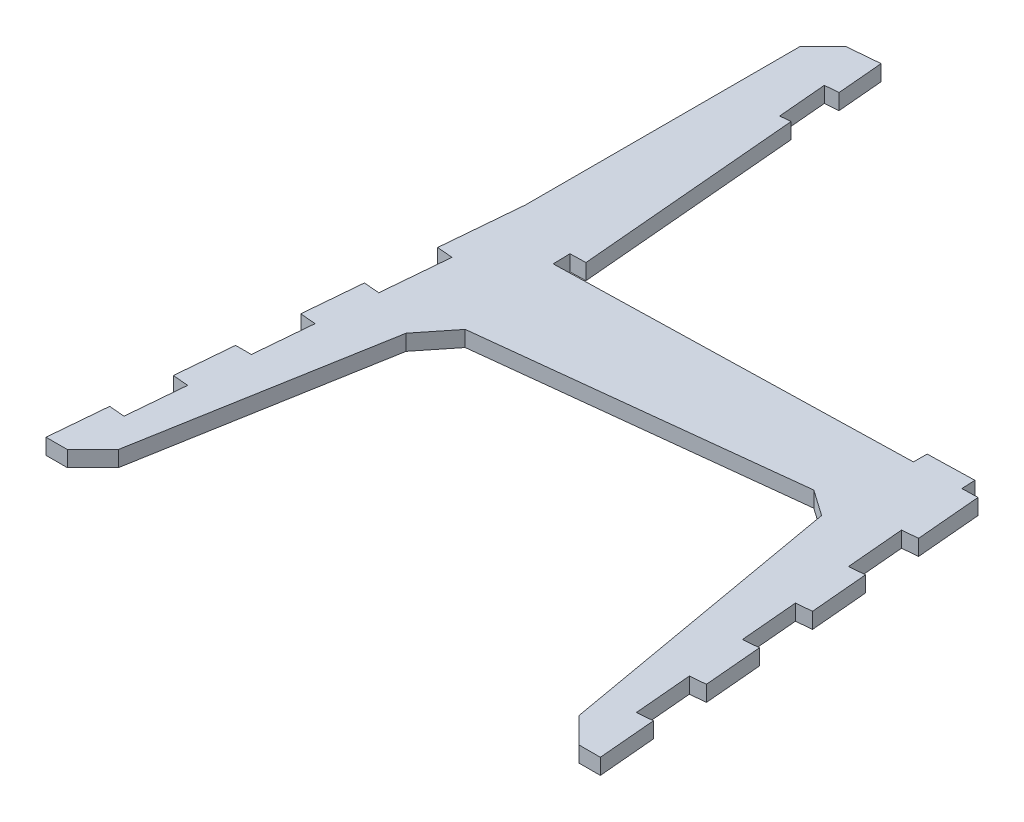
from build123d import *
from OCP.BRepFilletAPI import BRepFilletAPI_MakeChamfer

# Parameters (mm, degrees)
BOSS_EXTRUDE1_DEPTH = 15
CUT_EXTRUDE2_DEPTH  = 816.748946497
BOSS_EXTRUDE2_DEPTH = 15
BOSS_EXTRUDE3_DEPTH = 15
CHAMFER1_SIZE       = 20
CHAMFER1_SIZE2      = 22.009925117
CHAMFER2_SIZE       = 20
CHAMFER2_SIZE2      = 21.383906801
CHAMFER2_SIZE2_2    = 29.545676359
CHAMFER3_SIZE       = 20
CHAMFER3_SIZE2      = 24.656061036
CUT_EXTRUDE3_DEPTH  = 817.728441489


with BuildPart() as part:
    # Sketch3 → Boss-Extrude1 (new body)
    with BuildSketch(Plane(origin=(0, 0, 0), x_dir=(1, 0, 0), z_dir=(0, 1, 0))):
        Polygon((410, 0), (375.499079338, 394.347327661), (-3.698775856, 385.063270846), (-23.780817684, 615.47886016), (-33.743052085, 614.610594222), (-41.626962847, 705.068325562), (-61.474466641, 703.331893981), (-81.398360603, 701.588779126), (-81.491356741, 420.124681698), (-118.247503657, 0), (-77.901012172, 0), (-27.385966046, 286.485062711), (312.415130717, 324.614971391), (369.653508515, 0), align=None)
    extrude(amount=-BOSS_EXTRUDE1_DEPTH)

    # Sketch4 → Cut-Extrude2 (cut, through all)
    with BuildSketch(Plane(origin=(0, 0, 0), x_dir=(1, 0, 0), z_dir=(0, 1, 0))):
        Polygon((-20.036108533, 401.037382744), (-19.638496356, 384.673012123), (-3.698775856, 385.063270846), (-5.122834429, 401.402510558), align=None)
    extrude(amount=-CUT_EXTRUDE2_DEPTH, mode=Mode.SUBTRACT)

    # Sketch5 → Boss-Extrude2 (add)
    with BuildSketch(Plane(origin=(0, 0, 0), x_dir=(1, 0, 0), z_dir=(0, 1, 0))):
        Polygon((-41.626962847, 705.068325562), (-28.676431065, 706.20135028), (-24.852581449, 662.327596289), (-37.80348617, 661.198850569), align=None)
    extrude(amount=-BOSS_EXTRUDE2_DEPTH)

    # Sketch6 → Boss-Extrude3 (add)
    with BuildSketch(Plane(origin=(0, 0, 0), x_dir=(1, 0, 0), z_dir=(0, 1, 0))):
        Polygon((315.438962688, 392.87685116), (360.503573098, 393.980186523), (359.842168491, 407.025169305), (315.461186161, 405.938571489), align=None)
    extrude(amount=-BOSS_EXTRUDE3_DEPTH)

    # Chamfer1
    chamfer1_edges = [part.edges().sort_by_distance(p)[0] for p in [
        (-81.398360603, -7.5, -701.588779126),
    ]]
    chamfer1_side = [part.faces().sort_by_distance(p)[0] for p in [
        (-81.444858672, -7.5, -560.856730412),
    ]]
    chamfer(chamfer1_edges, length=CHAMFER1_SIZE, length2=CHAMFER1_SIZE2, reference=chamfer1_side[0])

    # Chamfer2: one chamfer whose edges measure the first distance from different faces: ONE call of the kernel's chamfer builder (chamfer() names one face for all edges)
    chamfer2_edges_1 = [part.edges().sort_by_distance(p)[0] for p in [
        (312.415130717, -7.5, -324.614971391),
    ]]
    chamfer2_side_1 = [part.faces().sort_by_distance(p)[0] for p in [
        (341.034319616, -7.5, -162.307485695),
    ]]
    chamfer2_edges_2 = [part.edges().sort_by_distance(p)[0] for p in [
        (-27.385966046, -7.5, -286.485062711),
    ]]
    chamfer2_side_2 = [part.faces().sort_by_distance(p)[0] for p in [
        (142.514582336, -7.5, -305.550017051),
    ]]
    chamfer2 = BRepFilletAPI_MakeChamfer(part.part.solid().wrapped)
    for e in chamfer2_edges_1:
        chamfer2.Add(CHAMFER2_SIZE, CHAMFER2_SIZE2, e.wrapped, chamfer2_side_1[0].wrapped)  # the first distance lies on this face
    for e in chamfer2_edges_2:
        chamfer2.Add(CHAMFER2_SIZE, CHAMFER2_SIZE2_2, e.wrapped, chamfer2_side_2[0].wrapped)  # the first distance lies on this face
    add(Compound.cast(chamfer2.Shape()), mode=Mode.REPLACE)

    # Chamfer3: one chamfer whose edges measure the first distance from different faces: ONE call of the kernel's chamfer builder (chamfer() names one face for all edges)
    chamfer3_edges_1 = [part.edges().sort_by_distance(p)[0] for p in [
        (369.653508515, -7.5, 0),
    ]]
    chamfer3_side_1 = [part.faces().sort_by_distance(p)[0] for p in [
        (389.826754258, -7.5, 0),
    ]]
    chamfer3_edges_2 = [part.edges().sort_by_distance(p)[0] for p in [
        (-77.901012172, -7.5, 0),
    ]]
    chamfer3_side_2 = [part.faces().sort_by_distance(p)[0] for p in [
        (-98.074257914, -7.5, 0),
    ]]
    chamfer3 = BRepFilletAPI_MakeChamfer(part.part.solid().wrapped)
    for e in chamfer3_edges_1:
        chamfer3.Add(CHAMFER3_SIZE, CHAMFER3_SIZE2, e.wrapped, chamfer3_side_1[0].wrapped)  # the first distance lies on this face
    for e in chamfer3_edges_2:
        chamfer3.Add(CHAMFER3_SIZE, CHAMFER3_SIZE2, e.wrapped, chamfer3_side_2[0].wrapped)  # the first distance lies on this face
    add(Compound.cast(chamfer3.Shape()), mode=Mode.REPLACE)

    # Sketch9 → Cut-Extrude3 (cut, through all)
    with BuildSketch(Plane(origin=(0, 0, 0), x_dir=(1, 0, 0), z_dir=(0, 1, 0))):
        Polygon((-73.280468193, 341.864865291), (-78.892311228, 277.721205877), (-93.835666105, 279.028580024), (-88.223823069, 343.172239438), align=None)
        Polygon((-98.717946571, 223.223858938), (-83.774591695, 221.916484791), (-88.656865511, 166.111839714), (-103.714600804, 166.111839714), align=None)
        Polygon((-93.539152627, 110.307042618), (-108.482507504, 111.614416765), (-113.36478797, 55.809695678), (-98.421433094, 54.502321532), align=None)
        Polygon((380.927264722, 332.302884814), (365.983909846, 330.995510667), (370.829365725, 275.611696532), (385.772720602, 276.919070678), align=None)
        Polygon((390.618176481, 221.535256543), (375.674821605, 220.227882396), (380.520277485, 164.84406826), (395.463632361, 166.151442407), align=None)
        Polygon((385.365733364, 109.460254125), (390.211189244, 54.076439989), (405.15454412, 55.383814136), (400.309088241, 110.767628271), align=None)
    extrude(amount=-CUT_EXTRUDE3_DEPTH, mode=Mode.SUBTRACT)


solid = part.part
